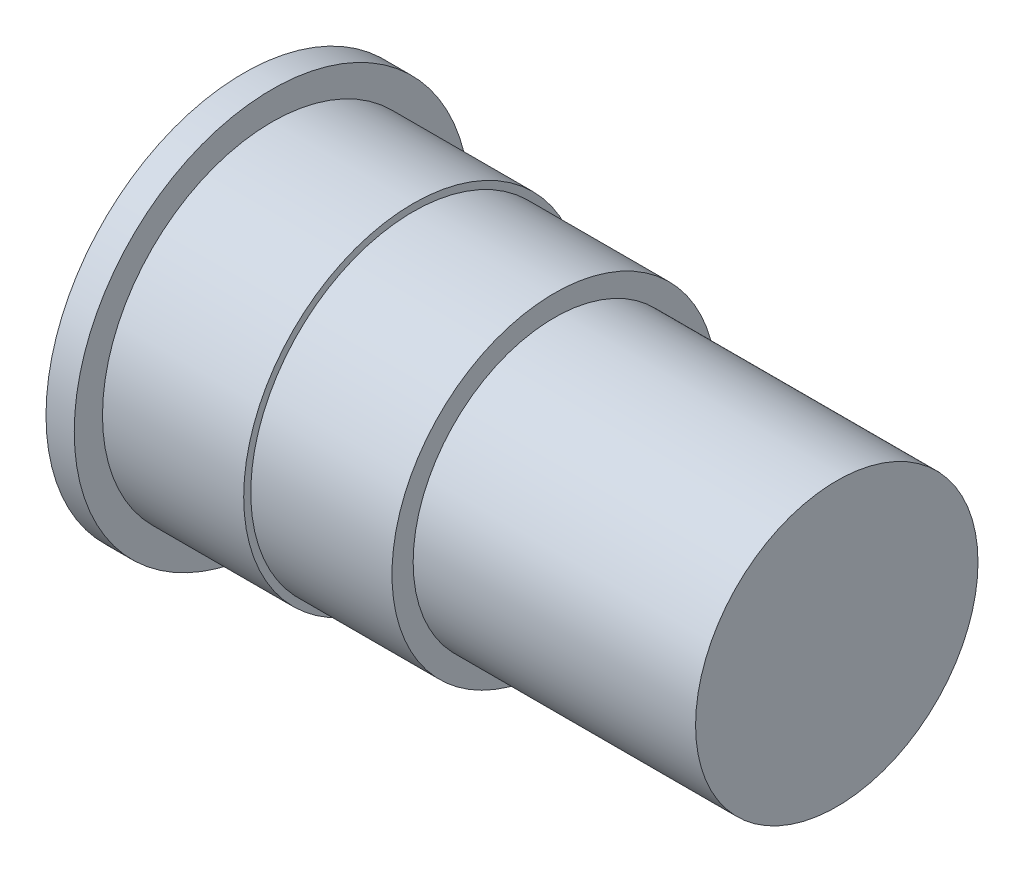
from build123d import *

# Parameters (mm, degrees)
SKETCH_1_R      = 7
EXTRUDE_1_DEPTH = 1
SKETCH_2_R      = 6
EXTRUDE_2_DEPTH = 5
SKETCH_3_R      = 5.75
EXTRUDE_3_DEPTH = 5
SKETCH_4_R      = 5
EXTRUDE_4_DEPTH = 10


with BuildPart() as part:
    # 草图1 → 凸台-拉伸1 (new body)
    with BuildSketch(Plane(origin=(0, 0, 0), x_dir=(0, 0, -1), z_dir=(1, 0, 0))):
        Circle(SKETCH_1_R)
    extrude(amount=EXTRUDE_1_DEPTH)

    # 草图2 → 凸台-拉伸2 (add)
    with BuildSketch(Plane(origin=(1, 0, 0), x_dir=(0, 0, -1), z_dir=(1, 0, 0))):
        Circle(SKETCH_2_R)
    extrude(amount=EXTRUDE_2_DEPTH)

    # 草图3 → 凸台-拉伸3 (add)
    with BuildSketch(Plane(origin=(6, 0, 0), x_dir=(0, 0, -1), z_dir=(1, 0, 0))):
        Circle(SKETCH_3_R)
    extrude(amount=EXTRUDE_3_DEPTH)

    # 草图4 → 凸台-拉伸4 (add)
    with BuildSketch(Plane(origin=(11, 0, 0), x_dir=(0, 0, -1), z_dir=(1, 0, 0))):
        Circle(SKETCH_4_R)
    extrude(amount=EXTRUDE_4_DEPTH)


solid = part.part
